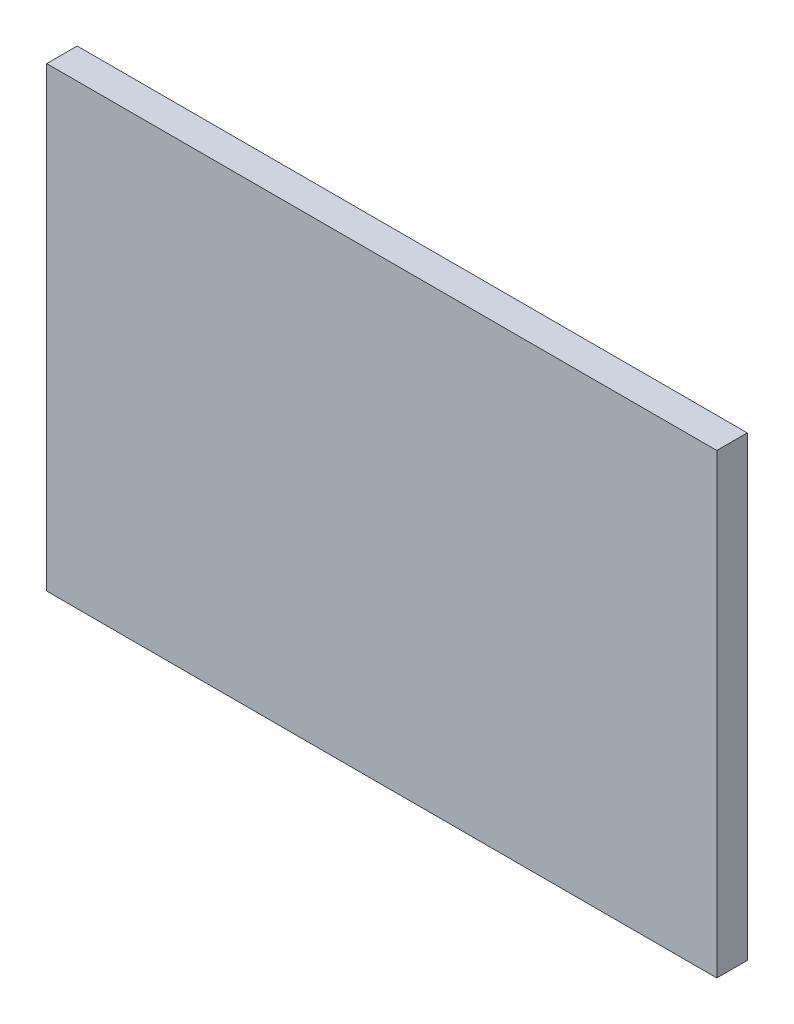
from build123d import *

# Parameters (mm, degrees)
CROQUIS1_W              = 22000
CROQUIS1_H              = 15000
SALIENTE_EXTRUIR2_DEPTH = 1000


with BuildPart() as part:
    # Croquis1 → Saliente-Extruir2 (new body)
    with BuildSketch(Plane(origin=(37728.547017751, 1888.55436109, 0), x_dir=(1, 0, 0), z_dir=(0, 0, 1))):
        with Locations((-11281.553398058, 6480.582524272)):
            Rectangle(CROQUIS1_W, CROQUIS1_H)
    extrude(amount=SALIENTE_EXTRUIR2_DEPTH)


solid = part.part
